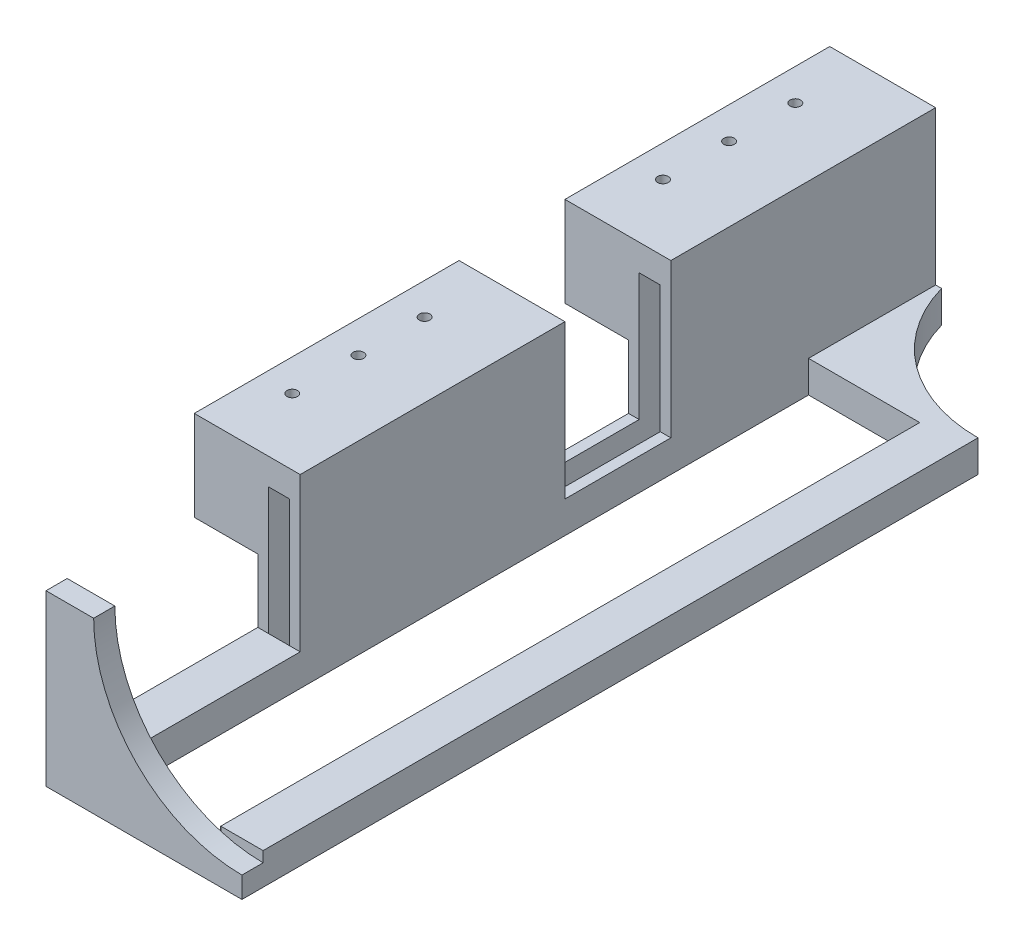
from build123d import *

# Parameters (mm, degrees)
SALIENTE_EXTRUIR1_DEPTH = 82
CROQUIS3_W              = 10
CROQUIS3_H              = 25
SALIENTE_EXTRUIR2_DEPTH = 1.5
CROQUIS4_W              = 18.5
CROQUIS4_H              = 16
SALIENTE_EXTRUIR3_DEPTH = 2
CROQUIS5_R              = 14.5
CORTAR_EXTRUIR1_DEPTH   = 87.482953955
CROQUIS13_W             = 7.672796091
CROQUIS13_H             = 18.470403829
CROQUIS13_W_2           = 10
CROQUIS13_H_2           = 13
CROQUIS13_W_3           = 18
CORTAR_EXTRUIR9_DEPTH   = 13
CORTAR_EXTRUIR10_DEPTH  = 2
CROQUIS15_W             = 1.990683477
CROQUIS15_H             = 14
CORTAR_EXTRUIR11_DEPTH  = 60
CROQUIS16_W             = 10.5
CROQUIS16_H             = 66
CORTAR_EXTRUIR12_DEPTH  = 10
CROQUIS19_W             = 6
CROQUIS19_H             = 25
SALIENTE_EXTRUIR7_DEPTH = 7
CROQUIS23_R             = 0.5
CORTAR_EXTRUIR13_DEPTH  = 86.732440329


with BuildPart() as part:
    # Croquis2 → Saliente-Extruir1 (new body)
    with BuildSketch(Plane.XY):
        Polygon((-4.596277774, 11.502403514), (-4.596277774, -1.497596486), (9.903722226, -1.497596486), (9.903722226, -4.497596486), (-4.596277774, -4.497596486), (-8.596277774, -4.497596486), (-8.596277774, 11.502403514), align=None)
    extrude(amount=SALIENTE_EXTRUIR1_DEPTH)

    # Croquis3 → Saliente-Extruir2 (add)
    with BuildSketch(Plane(origin=(0, 11.502403514, 0), x_dir=(1, 0, 0), z_dir=(0, 1, 0))):
        with Locations((-9.596277774, -16.5)):
            Rectangle(CROQUIS3_W, CROQUIS3_H)
        with Locations((-9.596277774, -51.5)):
            Rectangle(CROQUIS3_W, CROQUIS3_H)
    extrude(amount=SALIENTE_EXTRUIR2_DEPTH)

    # Croquis4 → Saliente-Extruir3 (add)
    with BuildSketch(Plane.XY.offset(82)):
        with Locations((0.653722226, 3.502403514)):
            Rectangle(CROQUIS4_W, CROQUIS4_H)
    extrude(amount=SALIENTE_EXTRUIR3_DEPTH)

    # Croquis5 → Cortar-Extruir1 (cut, through all)
    with BuildSketch(Plane(origin=(0, -1.497596486, 0), x_dir=(1, 0, 0), z_dir=(0, 1, 0))):
        with Locations((9.903722226, 0)):
            Circle(CROQUIS5_R)
    extrude(amount=-CORTAR_EXTRUIR1_DEPTH, mode=Mode.SUBTRACT)

    # Croquis13 → Cortar-Extruir9 (cut)
    with BuildSketch(Plane.ZY.offset(8.596277774)):
        with Locations((0.163601954, 2.2672016)):
            Rectangle(CROQUIS13_W, CROQUIS13_H)
        with Locations((34, 5.002403514)):
            Rectangle(CROQUIS13_W_2, CROQUIS13_H_2)
        with Locations((73, 5.002403514)):
            Rectangle(CROQUIS13_W_3, CROQUIS13_H_2)
    extrude(amount=-CORTAR_EXTRUIR9_DEPTH, mode=Mode.SUBTRACT)

    # Croquis14 → Cortar-Extruir10 (cut)
    with BuildSketch(Plane.XY.offset(84)):
        with BuildLine():
            Line((-4.096277774, 11.502403514), (9.903722226, 11.502403514))
            Line((9.903722226, 11.502403514), (9.903722226, -2.497596486))
            ThreePointArc((9.903722226, -2.497596486), (0.00422729, 1.602908577), (-4.096277774, 11.502403514))
        make_face()
    extrude(amount=-CORTAR_EXTRUIR10_DEPTH, mode=Mode.SUBTRACT)

    # Croquis15 → Cortar-Extruir11 (cut)
    with BuildSketch(Plane(origin=(0, 0, 4), x_dir=(-1, 0, 0), z_dir=(0, 0, -1))):
        with Locations((6.596277774, 3.502403514)):
            Rectangle(CROQUIS15_W, CROQUIS15_H)
    extrude(amount=-CORTAR_EXTRUIR11_DEPTH, mode=Mode.SUBTRACT)

    # Croquis16 → Cortar-Extruir12 (cut)
    with BuildSketch(Plane.XZ.offset(4.497596486)):
        with Locations((0.653722226, 49)):
            Rectangle(CROQUIS16_W, CROQUIS16_H)
    extrude(amount=-CORTAR_EXTRUIR12_DEPTH, mode=Mode.SUBTRACT)

    # Croquis19 → Saliente-Extruir7 (add)
    with BuildSketch(Plane.XZ.offset(-11.502403514)):
        with Locations((-11.596277774, 16.5)):
            Rectangle(CROQUIS19_W, CROQUIS19_H)
        with Locations((-11.596277774, 51.5)):
            Rectangle(CROQUIS19_W, CROQUIS19_H)
    extrude(amount=SALIENTE_EXTRUIR7_DEPTH)

    # Croquis23 → Cortar-Extruir13 (cut, symmetric)
    with BuildSketch(Plane.XZ.offset(-4.502403514)):
        with Locations(Location((-11.596277774, 45.25, 0), (0, 0, 270))):
            Circle(CROQUIS23_R)
        with Locations(Location((-11.596277774, 57.75, 0), (0, 0, 270))):
            Circle(CROQUIS23_R)
        with Locations(Location((-11.596277774, 51.5, 0), (0, 0, 270))):
            Circle(CROQUIS23_R)
    cortar_extruir13 = extrude(amount=CORTAR_EXTRUIR13_DEPTH, both=True, mode=Mode.SUBTRACT)

    # Simetría1: Cortar-Extruir13 across plane
    add(cortar_extruir13.mirror(Plane(origin=(0, 0, 34), x_dir=(1, 0, 0), z_dir=(0, 0, -1))), mode=Mode.SUBTRACT)


solid = part.part
